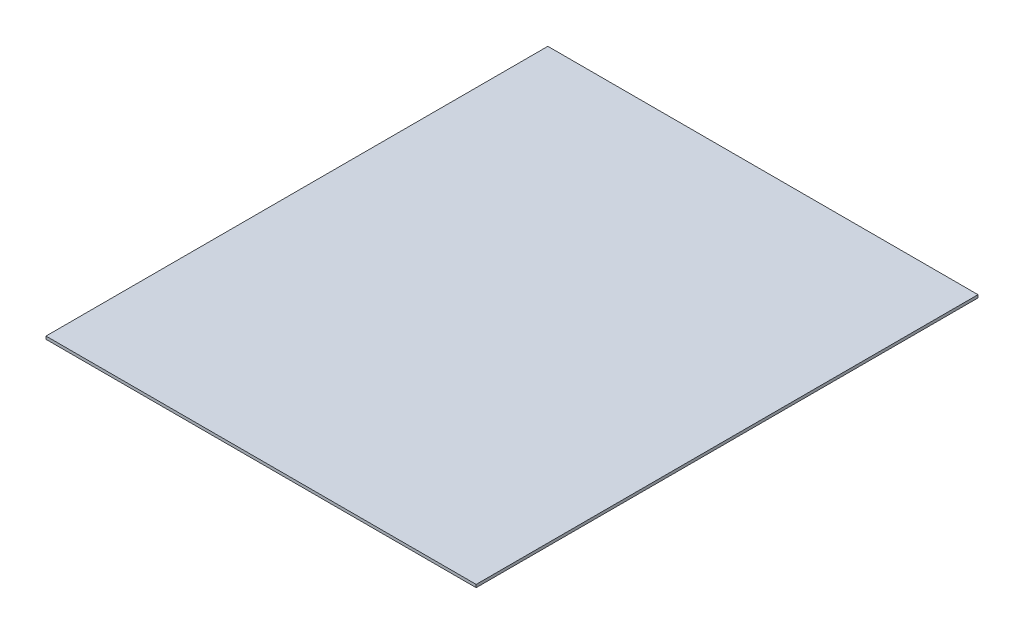
from build123d import *

# Parameters (mm, degrees)
ESQUISSE1_W        = 300
ESQUISSE1_H        = 350
BOSS_EXTRU_1_DEPTH = 2


with BuildPart() as part:
    # Esquisse1 → Boss.-Extru.1 (new body)
    with BuildSketch(Plane(origin=(0, 0, 0), x_dir=(1, 0, 0), z_dir=(0, 1, 0))):
        with Locations((-150, 175)):
            Rectangle(ESQUISSE1_W, ESQUISSE1_H)
    extrude(amount=BOSS_EXTRU_1_DEPTH)


solid = part.part
